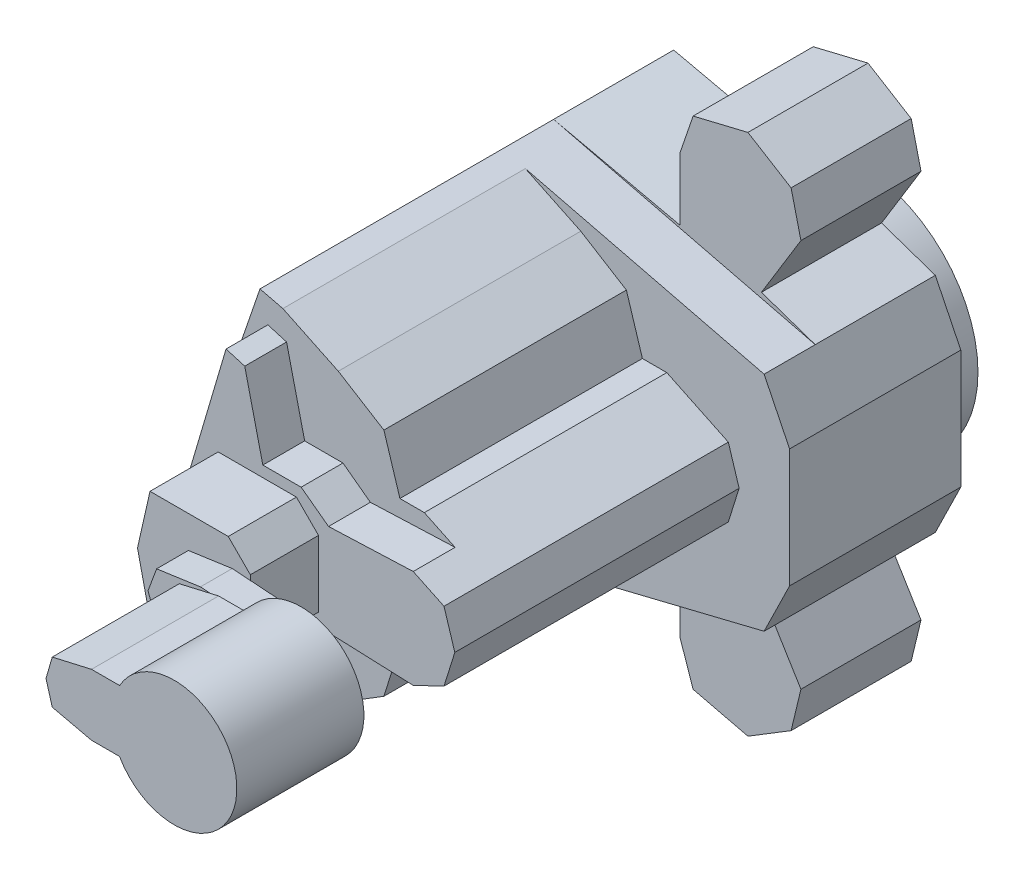
from build123d import *

# Parameters (mm, degrees)
BOSS_EXTRUDE1_DEPTH = 155
BOSS_EXTRUDE2_DEPTH = 66
BOSS_EXTRUDE3_DEPTH = 313
BOSS_EXTRUDE4_DEPTH = 54
BOSS_EXTRUDE5_DEPTH = 88
BOSS_EXTRUDE6_DEPTH = 41
BOSS_EXTRUDE7_DEPTH = 164
BOSS_EXTRUDE8_DEPTH = 63


with BuildPart() as part:
    # Sketch1 → Boss-Extrude1 (new body)
    with BuildSketch(Plane.XY):
        Polygon((-220.063797357, 0), (-198.907917785, -153.12825629), (-173.722346865, -226.670123376), (-10.519847306, -189.899189833), (-10.519847306, -270.996728194), (6.417174186, -320.452830951), (77.125939495, -337.486635422), (132.857093021, -303.394090716), (145.53009844, -250.787371679), (94.572304418, -167.486560125), (164.014799865, -143.704883603), (180.076897751, -110.911433751), (196.900067844, -76.564128145), (196.900067844, 0), align=None)
    boss_extrude1 = extrude(amount=BOSS_EXTRUDE1_DEPTH)

    # Sketch2 → Boss-Extrude2 (add)
    with BuildSketch(Plane.XY.offset(155)):
        Polygon((-220.063797357, 0), (-198.907917785, -153.12825629), (-173.722346865, -226.670123376), (164.014799865, -143.704883603), (196.900067844, -76.564128145), (196.900067844, 0), align=None)
    boss_extrude2 = extrude(amount=BOSS_EXTRUDE2_DEPTH)

    # Sketch3 → Boss-Extrude3 (add)
    with BuildSketch(Plane.XY.offset(221)):
        Polygon((-220.063797357, 0), (-198.907917785, -153.12825629), (-173.722346865, -226.670123376), (-144.188560723, -219.415139219), (-72.64388975, -185.187503489), (-13.784604036, -148.831636487), (0, -104.745103877), (6.910898911, -82.642360162), (38.419722404, -82.642360162), (117.796003981, -44.66800911), (131.76241917, 0), align=None)
    boss_extrude3 = extrude(amount=BOSS_EXTRUDE3_DEPTH)

    # Sketch4 → Boss-Extrude4 (add)
    with BuildSketch(Plane.XY.offset(534)):
        Polygon((-220.063797357, 0), (-163.514117876, -191.576655197), (-139.411479093, -184.462027915), (-116.05966541, -85.56138905), (-66.585874541, -85.56138905), (-31.247452492, -59.309989814), (78.107863193, -63.655184636), (117.796003981, -44.66800911), (131.76241917, 0), align=None)
    boss_extrude4 = extrude(amount=BOSS_EXTRUDE4_DEPTH)

    # Sketch5 → Boss-Extrude5 (add)
    with BuildSketch(Plane.XY.offset(588)):
        Polygon((-189.830764245, 0), (-173.676057022, -71.426020231), (-72.709136882, -71.426020231), (-44.150689094, -42.867572442), (-44.150689094, 0), align=None)
    boss_extrude5 = extrude(amount=BOSS_EXTRUDE5_DEPTH)

    # Sketch6 → Boss-Extrude6 (add)
    with BuildSketch(Plane.XY.offset(676)):
        with BuildLine():
            Line((-135.243392737, 0), (-124.137031521, -30.029582973))
            Line((-124.137031521, -30.029582973), (-67.595556243, -38.106936584))
            Line((-67.595556243, -38.106936584), (-9.982142183, -34.068259779))
            ThreePointArc((-9.982142183, -34.068259779), (-10.876517561, -17.044564178), (-11.174764407, 0))
            Line((-11.174764407, 0), (-135.243392737, 0))
        make_face()
    boss_extrude6 = extrude(amount=BOSS_EXTRUDE6_DEPTH)

    # Sketch7 → Boss-Extrude7 (add)
    with BuildSketch(Plane.XY.offset(717)):
        with BuildLine():
            Line((-102.933978292, 0), (-94.85662468, -28.01024457))
            Line((-94.85662468, -28.01024457), (-44.150689094, -39.665516705))
            Line((-44.150689094, -39.665516705), (-7.961701602, -39.665516705))
            ThreePointArc((-7.961701602, -39.665516705), (83.027852783, -78.239664369), (143.40681265, 0))
            Line((143.40681265, 0), (-7.961701602, 0))
            Line((-7.961701602, 0), (-102.933978292, 0))
        make_face()
    boss_extrude7 = extrude(amount=BOSS_EXTRUDE7_DEPTH)

    # Sketch8 → Boss-Extrude8 (add)
    with BuildSketch(Plane(origin=(0, 0, 0), x_dir=(-1, 0, 0), z_dir=(0, 0, -1))):
        with BuildLine():
            Line((-156.103280221, 0), (156.103280221, 0))
            ThreePointArc((156.103280221, 0), (0, -156.103280221), (-156.103280221, 0))
        make_face()
    boss_extrude8 = extrude(amount=BOSS_EXTRUDE8_DEPTH)

    # Mirror1: Boss-Extrude1, Boss-Extrude2, Boss-Extrude3, Boss-Extrude4, Boss-Extrude5, Boss-Extrude6, Boss-Extrude7, Boss-Extrude8 across plane
    add(boss_extrude1.mirror(Plane(origin=(196.900067844, 0, 155), x_dir=(0, 0, 1), z_dir=(0, -1, 0))))
    add(boss_extrude2.mirror(Plane(origin=(196.900067844, 0, 155), x_dir=(0, 0, 1), z_dir=(0, -1, 0))))
    add(boss_extrude3.mirror(Plane(origin=(196.900067844, 0, 155), x_dir=(0, 0, 1), z_dir=(0, -1, 0))))
    add(boss_extrude4.mirror(Plane(origin=(196.900067844, 0, 155), x_dir=(0, 0, 1), z_dir=(0, -1, 0))))
    add(boss_extrude5.mirror(Plane(origin=(196.900067844, 0, 155), x_dir=(0, 0, 1), z_dir=(0, -1, 0))))
    add(boss_extrude6.mirror(Plane(origin=(196.900067844, 0, 155), x_dir=(0, 0, 1), z_dir=(0, -1, 0))))
    add(boss_extrude7.mirror(Plane(origin=(196.900067844, 0, 155), x_dir=(0, 0, 1), z_dir=(0, -1, 0))))
    add(boss_extrude8.mirror(Plane(origin=(196.900067844, 0, 155), x_dir=(0, 0, 1), z_dir=(0, -1, 0))))


solid = part.part
